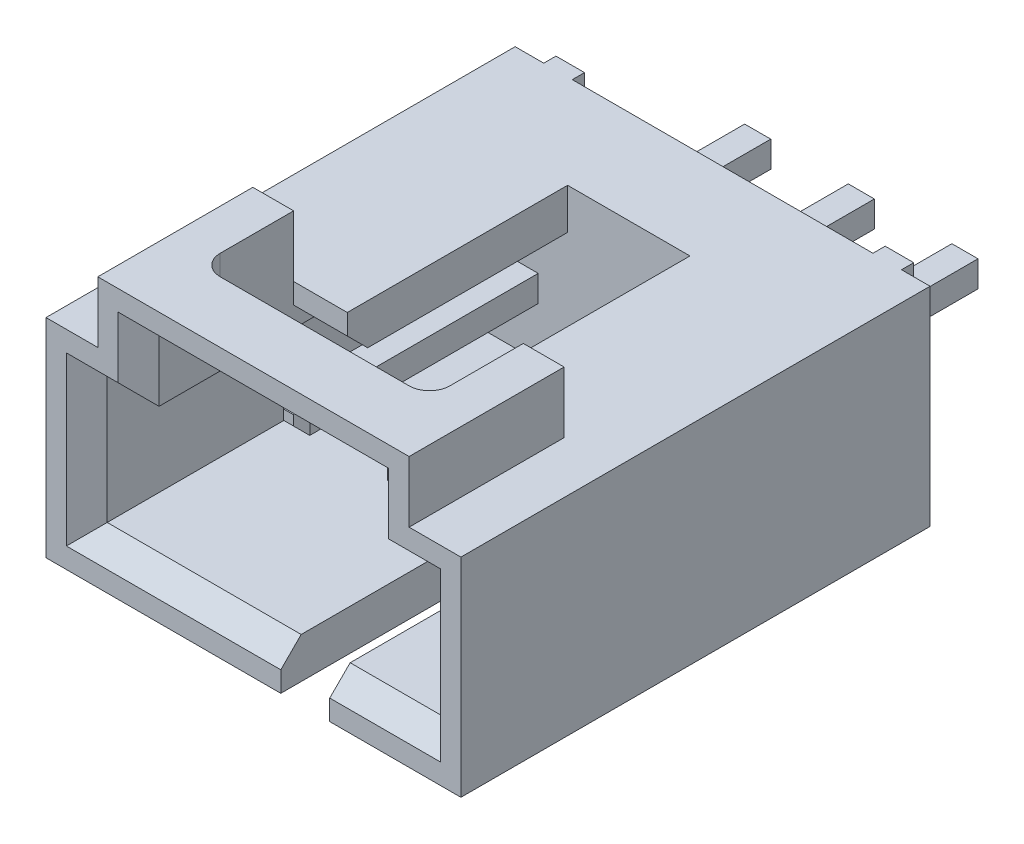
from build123d import *

# Parameters (mm, degrees)
EXTRUDE_1_DEPTH                    = 2.55
CUT_EXTRUDE_1_DEPTH                = 9.2
EXTRUDE_2_DEPTH                    = 3.8
SKETCH_4_W                         = 5.63
SKETCH_4_H                         = 1
CUT_EXTRUDE_2_DEPTH                = 3.8
CUT_EXTRUDE_3_REACH                = 16.445
CHAMFER_1_SIZE                     = 0.5
EXTRUDE_START                      = -3.6
SKETCH_6_W                         = 0.64
SKETCH_6_H                         = 0.64
EXTRUDE_3_DEPTH                    = 11.7
CHAMFER_2_SIZE                     = 0.2
PATTERN_LINEAR_1_COUNT             = 3
PATTERN_LINEAR_1_PITCH             = 2.54
CHAMFER_2_OF_PATTERN_LINEAR_1_SIZE = 0.2


with BuildPart() as part:
    # Эскиз1 → Бобышка-Вытянуть1 (new, symmetric)
    with BuildSketch(Plane(origin=(0, 0, 0), x_dir=(1, 0, 0), z_dir=(0, 1, 0))):
        Polygon((-3.685, -0.3), (3.685, -0.3), (3.685, 0), (4.385, 0), (4.385, -0.3), (5.085, -0.3), (5.085, -11.8), (-5.085, -11.8), (-5.085, -0.3), (-4.385, -0.3), (-4.385, 0), (-3.685, 0), align=None)
    extrude(amount=EXTRUDE_1_DEPTH, both=True)

    # Эскиз2 → Вырез-Вытянуть1 (cut)
    with BuildSketch(Plane.XY.offset(11.8)):
        Polygon((-4.085, 1.55), (-4.085, -1.55), (0.67, -1.55), (0.67, -2.55), (1.87, -2.55), (1.87, -1.55), (4.085, -1.55), (4.085, 1.55), (1.5, 1.55), (1.5, 2.55), (-1.5, 2.55), (-1.5, 1.55), align=None)
    extrude(amount=-CUT_EXTRUDE_1_DEPTH, mode=Mode.SUBTRACT)

    # Эскиз3 → Бобышка-Вытянуть2 (add)
    with BuildSketch(Plane.XY.offset(11.8)):
        Polygon((-3.815, 2.55), (-3.815, 4.05), (3.815, 4.05), (3.815, 2.55), (2.815, 2.55), (2.815, 3.05), (-2.815, 3.05), (-2.815, 2.55), align=None)
    extrude(amount=-EXTRUDE_2_DEPTH)

    # Эскиз4 → Вырез-Вытянуть2 (cut)
    with BuildSketch(Plane.XY.offset(11.8)):
        with Locations((0, 2.05)):
            Rectangle(SKETCH_4_W, SKETCH_4_H)
    extrude(amount=-CUT_EXTRUDE_2_DEPTH, mode=Mode.SUBTRACT)

    # Эскиз5 → Вырез-Вытянуть3 (cut, up to next)
    with BuildSketch(Plane(origin=(0, 4.05, 0), x_dir=(1, 0, 0), z_dir=(0, 1, 0)), mode=Mode.PRIVATE) as cut_extrude_3_sk1:
        with BuildLine():
            Line((2.815, -8), (2.815, -9.8))
            ThreePointArc((2.815, -9.8), (2.668553391, -10.153553391), (2.315, -10.3))
            Line((2.315, -10.3), (-2.315, -10.3))
            ThreePointArc((-2.315, -10.3), (-2.668553391, -10.153553391), (-2.815, -9.8))
            Line((-2.815, -9.8), (-2.815, -8))
            Line((-2.815, -8), (2.815, -8))
        make_face()
    cut_extrude_3_tool1 = extrude(cut_extrude_3_sk1.sketch, amount=-CUT_EXTRUDE_3_REACH, mode=Mode.PRIVATE) & part.part
    add(cut_extrude_3_tool1.solids().sort_by_distance((0, 4.05, 9.141324))[0], mode=Mode.SUBTRACT)

    # Фаска1
    chamfer_1_edges = [part.edges().sort_by_distance(p)[0] for p in [
        (-2.1575, 1.55, 8),
        (-4.085, 0, 11.8),
        (-1.7075, -1.55, 11.8),
        (2.9775, -1.55, 11.8),
        (4.085, 0, 11.8),
        (3.45, 1.55, 11.8),
        (-2.815, 2.3, 11.8),
        (0, 3.05, 11.8),
        (2.815, 2.3, 11.8),
        (2.1575, 1.55, 8),
        (-3.45, 1.55, 11.8),
    ]]
    chamfer(chamfer_1_edges, length=CHAMFER_1_SIZE)

    # Эскиз6 → Бобышка-Вытянуть3 (add)
    with BuildSketch(Plane.XY.offset(0.3).offset(EXTRUDE_START)):
        with Locations((2.54, 0)):
            Rectangle(SKETCH_6_W, SKETCH_6_H)
    extrude_3 = extrude(amount=EXTRUDE_3_DEPTH)

    # Фаска2
    chamfer_2_edges = [part.edges().sort_by_distance(p)[0] for p in [
        (2.54, 0.32, 8.4),
        (2.86, 0, 8.4),
        (2.54, -0.32, 8.4),
        (2.22, 0, 8.4),
        (2.22, 0, -3.3),
        (2.54, 0.32, -3.3),
        (2.86, 0, -3.3),
        (2.54, -0.32, -3.3),
    ]]
    chamfer(chamfer_2_edges, length=CHAMFER_2_SIZE)

    # Линейный массив1: Бобышка-Вытянуть3 ×3
    with Locations(*[(-i * PATTERN_LINEAR_1_PITCH, 0, 0) for i in range(1, PATTERN_LINEAR_1_COUNT)]):
        add(extrude_3)

    # Фаска2 of Линейный массив1
    chamfer_2_of_pattern_linear_1_edges = [part.edges().sort_by_distance(p)[0] for p in [
        (0, 0.32, 8.4),
        (0.32, 0, 8.4),
        (0, -0.32, 8.4),
        (-0.32, 0, 8.4),
        (-0.32, 0, -3.3),
        (0, 0.32, -3.3),
        (0.32, 0, -3.3),
        (0, -0.32, -3.3),
        (-2.54, 0.32, 8.4),
        (-2.22, 0, 8.4),
        (-2.54, -0.32, 8.4),
        (-2.86, 0, 8.4),
        (-2.86, 0, -3.3),
        (-2.54, 0.32, -3.3),
        (-2.22, 0, -3.3),
        (-2.54, -0.32, -3.3),
    ]]
    chamfer(chamfer_2_of_pattern_linear_1_edges, length=CHAMFER_2_OF_PATTERN_LINEAR_1_SIZE)


solid = part.part
